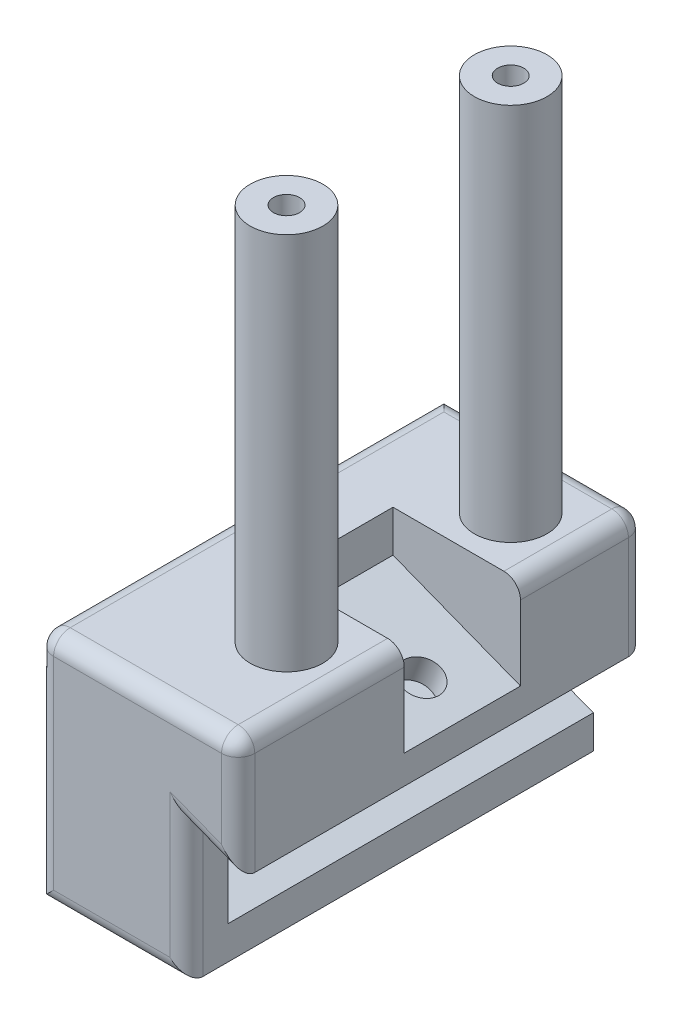
from build123d import *

# Parameters (mm, degrees)
BOSS_EXTRUDE1_DEPTH = 55.88
SKETCH2_W           = 22.86
SKETCH2_H           = 29.69248518
BOSS_EXTRUDE2_DEPTH = 6.35
BOSS_EXTRUDE3_DEPTH = 55.88
CUT_EXTRUDE1_DEPTH  = 55.88
BOSS_EXTRUDE5_DEPTH = 19.05
BOSS_EXTRUDE6_DEPTH = 19.05
SKETCH8_R           = 2.8575
CUT_EXTRUDE2_DEPTH  = 4.085289
SKETCH9_R           = 5.55625
BOSS_EXTRUDE7_DEPTH = 64.262
SKETCH11_R          = 1.999996
CUT_EXTRUDE3_DEPTH  = 6.99999997
BOSS_EXTRUDE8_DEPTH = 6.35
BOSS_EXTRUDE9_DEPTH = 6.35
FILLET3_R           = 2.54


with BuildPart() as part:
    # Sketch1 → Boss-Extrude1 (new body)
    with BuildSketch(Plane.XY):
        Polygon((0, 0), (22.86, 0), (22.86, 5.08), (0, 13.97), align=None)
    extrude(amount=BOSS_EXTRUDE1_DEPTH)

    # Sketch2 → Boss-Extrude2 (add)
    with BuildSketch(Plane.XY.offset(55.88)):
        with Locations((11.43, 14.84624259)):
            Rectangle(SKETCH2_W, SKETCH2_H)
    extrude(amount=BOSS_EXTRUDE2_DEPTH)

    # Sketch3 → Boss-Extrude3 (add)
    with BuildSketch(Plane(origin=(0, 0, 55.88), x_dir=(-1, 0, 0), z_dir=(0, 0, -1))):
        Polygon((-22.86, 29.69248518), (0, 29.69248518), (-30.774794254, 17.724509637), (-30.774794254, 29.69248518), align=None)
    extrude(amount=BOSS_EXTRUDE3_DEPTH)

    # Sketch5 → Cut-Extrude1 (cut)
    with BuildSketch(Plane(origin=(0, 0, 0), x_dir=(-1, 0, 0), z_dir=(0, 0, -1))):
        Polygon((-30.774794254, 22.107844851), (-11.271433408, 29.69248518), (-30.774794254, 29.69248518), align=None)
    extrude(amount=-CUT_EXTRUDE1_DEPTH, mode=Mode.SUBTRACT)

    # Sketch7 → Boss-Extrude6 (add)
    with BuildSketch(Plane.XY.offset(55.88)):
        Polygon((30.774794254, 22.107844851), (30.774794254, 29.69248518), (11.271433408, 29.69248518), align=None)
    extrude(amount=-BOSS_EXTRUDE6_DEPTH)

    # Sketch8 → Cut-Extrude2 (cut)
    with BuildSketch(Plane(origin=(11.510866943, 29.599372139, 0), x_dir=(0.9320046715412958, -0.36244626115494866, 0), z_dir=(0.36244626115494866, 0.9320046715412958, 0))):
        with Locations(Location((13.963299783, -27.94, 0), (0, 0, 180))):
            Circle(SKETCH8_R)
    extrude(amount=-CUT_EXTRUDE2_DEPTH, mode=Mode.SUBTRACT)



with BuildPart() as body_2:
    # Sketch6 → Boss-Extrude5 (new body)
    with BuildSketch(Plane(origin=(0, 0, 0), x_dir=(-1, 0, 0), z_dir=(0, 0, -1))):
        Polygon((-30.774794254, 29.69248518), (-30.774794254, 22.107844851), (-11.271433408, 29.69248518), align=None)
    extrude(amount=-BOSS_EXTRUDE5_DEPTH)


with BuildPart() as part_1:
    add(part.part)

    add(body_2.part)  # Boss-Extrude7 merges body 2
    # Sketch9 → Boss-Extrude7 (add)
    with BuildSketch(Plane(origin=(0, 29.69248518, 0), x_dir=(1, 0, 0), z_dir=(0, 1, 0))):
        with Locations(Location((21.023113831, -10.795, 0), (0, 0, 270))):
            Circle(SKETCH9_R)
        with Locations(Location((21.023113831, -45.085, 0), (0, 0, 270))):
            Circle(SKETCH9_R)
    extrude(amount=BOSS_EXTRUDE7_DEPTH)

    # Sketch11 → Cut-Extrude3 (cut)
    with BuildSketch(Plane(origin=(0, 93.95448518, 0), x_dir=(1, 0, 0), z_dir=(0, 1, 0))):
        with Locations(Location((21.023113831, -10.795, 0), (0, 0, 270))):
            Circle(SKETCH11_R)
        with Locations(Location((21.023113831, -45.085, 0), (0, 0, 270))):
            Circle(SKETCH11_R)
    extrude(amount=-CUT_EXTRUDE3_DEPTH, mode=Mode.SUBTRACT)

    # Sketch12 → Boss-Extrude8 (add)
    with BuildSketch(Plane.XY.offset(55.88)):
        Polygon((22.86, 29.69248518), (30.774794254, 29.69248518), (30.774794254, 17.724509637), (22.86, 20.80248518), align=None)
    extrude(amount=BOSS_EXTRUDE8_DEPTH)

    # Sketch14 → Boss-Extrude9 (add)
    with BuildSketch(Plane(origin=(0, 29.69248518, 0), x_dir=(1, 0, 0), z_dir=(0, 1, 0))):
        Polygon((0, 0), (0, -62.23), (30.774794254, -62.23), (30.774794254, -36.83), (11.271433408, -36.83), (11.271433408, -19.05), (30.774794254, -19.05), (30.774794254, 0), align=None)
    extrude(amount=BOSS_EXTRUDE9_DEPTH)

    # Fillet3
    fillet3_edges = [part_1.edges().sort_by_distance(p)[0] for p in [
        (0, 18.02124259, 62.23),
        (15.387397127, 36.04248518, 62.23),
        (30.774794254, 26.883497409, 0),
        (30.774794254, 26.883497409, 62.23),
        (26.817397127, 19.263497409, 62.23),
        (22.86, 10.40124259, 62.23),
        (11.43, 0, 62.23),
        (0, 6.985, 0),
        (15.387397127, 36.04248518, 0),
        (0, 36.04248518, 31.115),
        (30.774794254, 36.04248518, 49.53),
        (30.774794254, 36.04248518, 9.525),
    ]]
    fillet(fillet3_edges, radius=FILLET3_R)


solid = part_1.part
